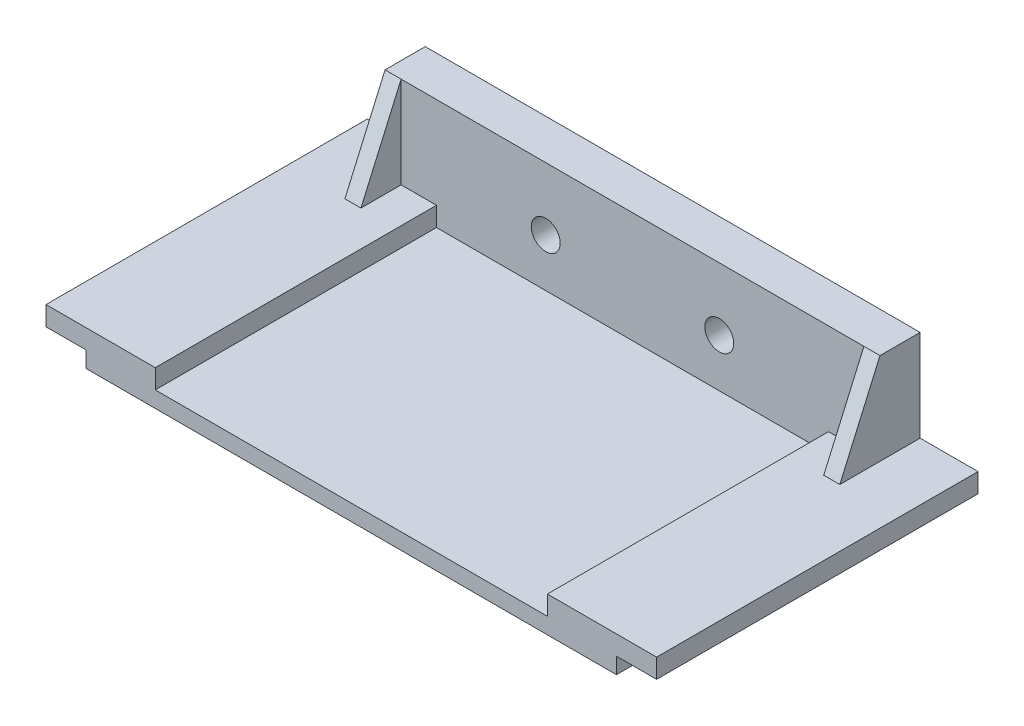
from build123d import *

# Parameters (mm, degrees)
SKETCH1_W           = 96.52
SKETCH1_H           = 50.8
BOSS_EXTRUDE1_DEPTH = 5.588
SKETCH2_W           = 61.976
SKETCH2_H           = 50.8
CUT_EXTRUDE2_DEPTH  = 3.048
SKETCH3_W           = 6.35
SKETCH3_H           = 50.8
CUT_EXTRUDE3_DEPTH  = 2.54
SKETCH4_W           = 78.232
SKETCH4_H           = 6.35
BOSS_EXTRUDE2_DEPTH = 17.526
SKETCH5_R           = 2.286
CUT_EXTRUDE4_DEPTH  = 73.885608703
BOSS_EXTRUDE3_DEPTH = 2.54
BOSS_EXTRUDE4_DEPTH = 2.54
SKETCH8_W           = 6.35
SKETCH8_H           = 8.89
CUT_EXTRUDE5_DEPTH  = 57.425172432
SKETCH9_W           = 6.35
SKETCH9_H           = 3.048
BOSS_EXTRUDE5_DEPTH = 8.89


with BuildPart() as part:
    # Sketch1 → Boss-Extrude1 (new body)
    with BuildSketch(Plane(origin=(0, 0, 0), x_dir=(1, 0, 0), z_dir=(0, 1, 0))):
        Rectangle(SKETCH1_W, SKETCH1_H)
    extrude(amount=BOSS_EXTRUDE1_DEPTH)

    # Sketch2 → Cut-Extrude2 (cut)
    with BuildSketch(Plane(origin=(0, 5.588, 0), x_dir=(1, 0, 0), z_dir=(0, 1, 0))):
        Rectangle(SKETCH2_W, SKETCH2_H)
    extrude(amount=-CUT_EXTRUDE2_DEPTH, mode=Mode.SUBTRACT)

    # Sketch3 → Cut-Extrude3 (cut)
    with BuildSketch(Plane(origin=(0, 0, 0), x_dir=(-1, 0, 0), z_dir=(0, -1, 0))):
        with Locations((-45.085, 0)):
            Rectangle(SKETCH3_W, SKETCH3_H)
        with Locations((45.085, 0)):
            Rectangle(SKETCH3_W, SKETCH3_H)
    extrude(amount=-CUT_EXTRUDE3_DEPTH, mode=Mode.SUBTRACT)

    # Sketch4 → Boss-Extrude2 (add)
    with BuildSketch(Plane(origin=(0, 2.54, 0), x_dir=(1, 0, 0), z_dir=(0, 1, 0))):
        with Locations((0, 22.225)):
            Rectangle(SKETCH4_W, SKETCH4_H)
    extrude(amount=BOSS_EXTRUDE2_DEPTH)

    # Sketch5 → Cut-Extrude4 (cut, through all)
    with BuildSketch(Plane(origin=(0, 0, -25.4), x_dir=(-1, 0, 0), z_dir=(0, 0, -1))):
        with Locations((13.716, 10.16)):
            Circle(SKETCH5_R)
        with Locations((-13.716, 10.16)):
            Circle(SKETCH5_R)
    extrude(amount=-CUT_EXTRUDE4_DEPTH, mode=Mode.SUBTRACT)

    # Sketch6 → Boss-Extrude3 (add)
    with BuildSketch(Plane.ZY.offset(39.116)):
        Polygon((-19.05, 5.588), (-12.7, 5.588), (-19.05, 20.066), align=None)
    extrude(amount=-BOSS_EXTRUDE3_DEPTH)

    # Sketch7 → Boss-Extrude4 (add)
    with BuildSketch(Plane(origin=(39.116, 0, 0), x_dir=(0, 0, -1), z_dir=(1, 0, 0))):
        Polygon((19.05, 5.588), (19.05, 20.066), (12.7, 5.588), align=None)
    extrude(amount=-BOSS_EXTRUDE4_DEPTH)

    # Sketch8 → Cut-Extrude5 (cut, through all)
    with BuildSketch(Plane(origin=(0, 5.588, 0), x_dir=(1, 0, 0), z_dir=(0, 1, 0))):
        with Locations((45.085, 20.955)):
            Rectangle(SKETCH8_W, SKETCH8_H)
        with Locations((-45.085, 20.955)):
            Rectangle(SKETCH8_W, SKETCH8_H)
    extrude(amount=-CUT_EXTRUDE5_DEPTH, mode=Mode.SUBTRACT)

    # Sketch9 → Boss-Extrude5 (add)
    with BuildSketch(Plane(origin=(0, 0, -16.51), x_dir=(-1, 0, 0), z_dir=(0, 0, -1))):
        with Locations((-45.085, 4.064)):
            Rectangle(SKETCH9_W, SKETCH9_H)
        with Locations((45.085, 4.064)):
            Rectangle(SKETCH9_W, SKETCH9_H)
    extrude(amount=BOSS_EXTRUDE5_DEPTH)


solid = part.part
